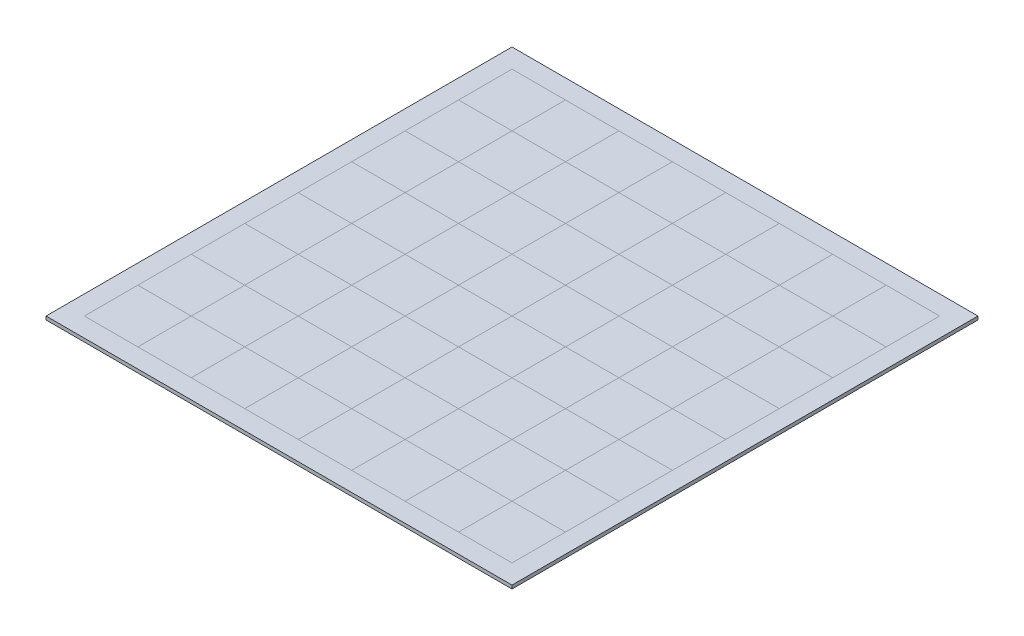
from build123d import *

# Parameters (mm, degrees)
SKETCH1_W              = 39
SKETCH1_H              = 39
BOSS_EXTRUDE1_DEPTH    = 2.5
BOSS_EXTRUDE1_2_DEPTH  = 2.5
BOSS_EXTRUDE1_3_DEPTH  = 2.5
BOSS_EXTRUDE1_4_DEPTH  = 2.5
BOSS_EXTRUDE1_5_DEPTH  = 2.5
BOSS_EXTRUDE1_6_DEPTH  = 2.5
BOSS_EXTRUDE1_7_DEPTH  = 2.5
BOSS_EXTRUDE1_8_DEPTH  = 2.5
BOSS_EXTRUDE1_9_DEPTH  = 2.5
BOSS_EXTRUDE1_10_DEPTH = 2.5
BOSS_EXTRUDE1_11_DEPTH = 2.5
BOSS_EXTRUDE1_12_DEPTH = 2.5
BOSS_EXTRUDE1_13_DEPTH = 2.5
BOSS_EXTRUDE1_14_DEPTH = 2.5
BOSS_EXTRUDE1_15_DEPTH = 2.5
BOSS_EXTRUDE1_16_DEPTH = 2.5
BOSS_EXTRUDE1_17_DEPTH = 2.5
BOSS_EXTRUDE1_18_DEPTH = 2.5
BOSS_EXTRUDE1_19_DEPTH = 2.5
BOSS_EXTRUDE1_20_DEPTH = 2.5
BOSS_EXTRUDE1_21_DEPTH = 2.5
BOSS_EXTRUDE1_22_DEPTH = 2.5
BOSS_EXTRUDE1_23_DEPTH = 2.5
BOSS_EXTRUDE1_24_DEPTH = 2.5
BOSS_EXTRUDE1_25_DEPTH = 2.5
BOSS_EXTRUDE1_26_DEPTH = 2.5
BOSS_EXTRUDE1_27_DEPTH = 2.5
BOSS_EXTRUDE1_28_DEPTH = 2.5
BOSS_EXTRUDE1_29_DEPTH = 2.5
BOSS_EXTRUDE1_30_DEPTH = 2.5
BOSS_EXTRUDE1_31_DEPTH = 2.5
BOSS_EXTRUDE1_32_DEPTH = 2.5
SKETCH4_W              = 39
SKETCH4_H              = 39
BOSS_EXTRUDE2_DEPTH    = 2.5
BOSS_EXTRUDE2_2_DEPTH  = 2.5
BOSS_EXTRUDE2_3_DEPTH  = 2.5
BOSS_EXTRUDE2_4_DEPTH  = 2.5
BOSS_EXTRUDE2_5_DEPTH  = 2.5
BOSS_EXTRUDE2_6_DEPTH  = 2.5
BOSS_EXTRUDE2_7_DEPTH  = 2.5
BOSS_EXTRUDE2_8_DEPTH  = 2.5
BOSS_EXTRUDE2_9_DEPTH  = 2.5
BOSS_EXTRUDE2_10_DEPTH = 2.5
BOSS_EXTRUDE2_11_DEPTH = 2.5
BOSS_EXTRUDE2_12_DEPTH = 2.5
BOSS_EXTRUDE2_13_DEPTH = 2.5
BOSS_EXTRUDE2_14_DEPTH = 2.5
BOSS_EXTRUDE2_15_DEPTH = 2.5
BOSS_EXTRUDE2_16_DEPTH = 2.5
BOSS_EXTRUDE2_17_DEPTH = 2.5
BOSS_EXTRUDE2_18_DEPTH = 2.5
BOSS_EXTRUDE2_19_DEPTH = 2.5
BOSS_EXTRUDE2_20_DEPTH = 2.5
BOSS_EXTRUDE2_21_DEPTH = 2.5
BOSS_EXTRUDE2_22_DEPTH = 2.5
BOSS_EXTRUDE2_23_DEPTH = 2.5
BOSS_EXTRUDE2_24_DEPTH = 2.5
BOSS_EXTRUDE2_25_DEPTH = 2.5
BOSS_EXTRUDE2_26_DEPTH = 2.5
BOSS_EXTRUDE2_27_DEPTH = 2.5
BOSS_EXTRUDE2_28_DEPTH = 2.5
BOSS_EXTRUDE2_29_DEPTH = 2.5
BOSS_EXTRUDE2_30_DEPTH = 2.5
BOSS_EXTRUDE2_31_DEPTH = 2.5
BOSS_EXTRUDE2_32_DEPTH = 2.5
SKETCH5_W              = 340
SKETCH5_H              = 340
SKETCH5_W_2            = 312
SKETCH5_H_2            = 312
BOSS_EXTRUDE3_DEPTH    = 2.5


with BuildPart() as part:
    # Sketch1 → Boss-Extrude1 (new body)
    with BuildSketch(Plane(origin=(0, 0, 0), x_dir=(1, 0, 0), z_dir=(0, 1, 0))):
        Rectangle(SKETCH1_W, SKETCH1_H)
    extrude(amount=BOSS_EXTRUDE1_DEPTH)


with BuildPart() as body_2:
    # Sketch1 → Boss-Extrude1 2 (new body)
    with BuildSketch(Plane(origin=(0, 0, 0), x_dir=(1, 0, 0), z_dir=(0, 1, 0))):
        with Locations((39, 39)):
            Rectangle(SKETCH1_W, SKETCH1_H)
    extrude(amount=BOSS_EXTRUDE1_2_DEPTH)


with BuildPart() as body_3:
    # Sketch1 → Boss-Extrude1 3 (new body)
    with BuildSketch(Plane(origin=(0, 0, 0), x_dir=(1, 0, 0), z_dir=(0, 1, 0))):
        with Locations((78, 0)):
            Rectangle(SKETCH1_W, SKETCH1_H)
    extrude(amount=BOSS_EXTRUDE1_3_DEPTH)


with BuildPart() as body_4:
    # Sketch1 → Boss-Extrude1 4 (new body)
    with BuildSketch(Plane(origin=(0, 0, 0), x_dir=(1, 0, 0), z_dir=(0, 1, 0))):
        with Locations((0, 78)):
            Rectangle(SKETCH1_W, SKETCH1_H)
    extrude(amount=BOSS_EXTRUDE1_4_DEPTH)


with BuildPart() as body_5:
    # Sketch1 → Boss-Extrude1 5 (new body)
    with BuildSketch(Plane(origin=(0, 0, 0), x_dir=(1, 0, 0), z_dir=(0, 1, 0))):
        with Locations((78, 78)):
            Rectangle(SKETCH1_W, SKETCH1_H)
    extrude(amount=BOSS_EXTRUDE1_5_DEPTH)


with BuildPart() as body_6:
    # Sketch1 → Boss-Extrude1 6 (new body)
    with BuildSketch(Plane(origin=(0, 0, 0), x_dir=(1, 0, 0), z_dir=(0, 1, 0))):
        with Locations((39, 117)):
            Rectangle(SKETCH1_W, SKETCH1_H)
    extrude(amount=BOSS_EXTRUDE1_6_DEPTH)


with BuildPart() as body_7:
    # Sketch1 → Boss-Extrude1 7 (new body)
    with BuildSketch(Plane(origin=(0, 0, 0), x_dir=(1, 0, 0), z_dir=(0, 1, 0))):
        with Locations((0, 156)):
            Rectangle(SKETCH1_W, SKETCH1_H)
    extrude(amount=BOSS_EXTRUDE1_7_DEPTH)


with BuildPart() as body_8:
    # Sketch1 → Boss-Extrude1 8 (new body)
    with BuildSketch(Plane(origin=(0, 0, 0), x_dir=(1, 0, 0), z_dir=(0, 1, 0))):
        with Locations((39, 195)):
            Rectangle(SKETCH1_W, SKETCH1_H)
    extrude(amount=BOSS_EXTRUDE1_8_DEPTH)


with BuildPart() as body_9:
    # Sketch1 → Boss-Extrude1 9 (new body)
    with BuildSketch(Plane(origin=(0, 0, 0), x_dir=(1, 0, 0), z_dir=(0, 1, 0))):
        with Locations((0, 234)):
            Rectangle(SKETCH1_W, SKETCH1_H)
    extrude(amount=BOSS_EXTRUDE1_9_DEPTH)


with BuildPart() as body_10:
    # Sketch1 → Boss-Extrude1 10 (new body)
    with BuildSketch(Plane(origin=(0, 0, 0), x_dir=(1, 0, 0), z_dir=(0, 1, 0))):
        with Locations((39, 273)):
            Rectangle(SKETCH1_W, SKETCH1_H)
    extrude(amount=BOSS_EXTRUDE1_10_DEPTH)


with BuildPart() as body_11:
    # Sketch1 → Boss-Extrude1 11 (new body)
    with BuildSketch(Plane(origin=(0, 0, 0), x_dir=(1, 0, 0), z_dir=(0, 1, 0))):
        with Locations((78, 234)):
            Rectangle(SKETCH1_W, SKETCH1_H)
    extrude(amount=BOSS_EXTRUDE1_11_DEPTH)


with BuildPart() as body_12:
    # Sketch1 → Boss-Extrude1 12 (new body)
    with BuildSketch(Plane(origin=(0, 0, 0), x_dir=(1, 0, 0), z_dir=(0, 1, 0))):
        with Locations((117, 273)):
            Rectangle(SKETCH1_W, SKETCH1_H)
    extrude(amount=BOSS_EXTRUDE1_12_DEPTH)


with BuildPart() as body_13:
    # Sketch1 → Boss-Extrude1 13 (new body)
    with BuildSketch(Plane(origin=(0, 0, 0), x_dir=(1, 0, 0), z_dir=(0, 1, 0))):
        with Locations((117, 195)):
            Rectangle(SKETCH1_W, SKETCH1_H)
    extrude(amount=BOSS_EXTRUDE1_13_DEPTH)


with BuildPart() as body_14:
    # Sketch1 → Boss-Extrude1 14 (new body)
    with BuildSketch(Plane(origin=(0, 0, 0), x_dir=(1, 0, 0), z_dir=(0, 1, 0))):
        with Locations((156, 234)):
            Rectangle(SKETCH1_W, SKETCH1_H)
    extrude(amount=BOSS_EXTRUDE1_14_DEPTH)


with BuildPart() as body_15:
    # Sketch1 → Boss-Extrude1 15 (new body)
    with BuildSketch(Plane(origin=(0, 0, 0), x_dir=(1, 0, 0), z_dir=(0, 1, 0))):
        with Locations((195, 273)):
            Rectangle(SKETCH1_W, SKETCH1_H)
    extrude(amount=BOSS_EXTRUDE1_15_DEPTH)


with BuildPart() as body_16:
    # Sketch1 → Boss-Extrude1 16 (new body)
    with BuildSketch(Plane(origin=(0, 0, 0), x_dir=(1, 0, 0), z_dir=(0, 1, 0))):
        with Locations((195, 195)):
            Rectangle(SKETCH1_W, SKETCH1_H)
    extrude(amount=BOSS_EXTRUDE1_16_DEPTH)


with BuildPart() as body_17:
    # Sketch1 → Boss-Extrude1 17 (new body)
    with BuildSketch(Plane(origin=(0, 0, 0), x_dir=(1, 0, 0), z_dir=(0, 1, 0))):
        with Locations((234, 234)):
            Rectangle(SKETCH1_W, SKETCH1_H)
    extrude(amount=BOSS_EXTRUDE1_17_DEPTH)


with BuildPart() as body_18:
    # Sketch1 → Boss-Extrude1 18 (new body)
    with BuildSketch(Plane(origin=(0, 0, 0), x_dir=(1, 0, 0), z_dir=(0, 1, 0))):
        with Locations((273, 273)):
            Rectangle(SKETCH1_W, SKETCH1_H)
    extrude(amount=BOSS_EXTRUDE1_18_DEPTH)


with BuildPart() as body_19:
    # Sketch1 → Boss-Extrude1 19 (new body)
    with BuildSketch(Plane(origin=(0, 0, 0), x_dir=(1, 0, 0), z_dir=(0, 1, 0))):
        with Locations((273, 195)):
            Rectangle(SKETCH1_W, SKETCH1_H)
    extrude(amount=BOSS_EXTRUDE1_19_DEPTH)


with BuildPart() as body_20:
    # Sketch1 → Boss-Extrude1 20 (new body)
    with BuildSketch(Plane(origin=(0, 0, 0), x_dir=(1, 0, 0), z_dir=(0, 1, 0))):
        with Locations((234, 156)):
            Rectangle(SKETCH1_W, SKETCH1_H)
    extrude(amount=BOSS_EXTRUDE1_20_DEPTH)


with BuildPart() as body_21:
    # Sketch1 → Boss-Extrude1 21 (new body)
    with BuildSketch(Plane(origin=(0, 0, 0), x_dir=(1, 0, 0), z_dir=(0, 1, 0))):
        with Locations((195, 117)):
            Rectangle(SKETCH1_W, SKETCH1_H)
    extrude(amount=BOSS_EXTRUDE1_21_DEPTH)


with BuildPart() as body_22:
    # Sketch1 → Boss-Extrude1 22 (new body)
    with BuildSketch(Plane(origin=(0, 0, 0), x_dir=(1, 0, 0), z_dir=(0, 1, 0))):
        with Locations((156, 156)):
            Rectangle(SKETCH1_W, SKETCH1_H)
    extrude(amount=BOSS_EXTRUDE1_22_DEPTH)


with BuildPart() as body_23:
    # Sketch1 → Boss-Extrude1 23 (new body)
    with BuildSketch(Plane(origin=(0, 0, 0), x_dir=(1, 0, 0), z_dir=(0, 1, 0))):
        with Locations((78, 156)):
            Rectangle(SKETCH1_W, SKETCH1_H)
    extrude(amount=BOSS_EXTRUDE1_23_DEPTH)


with BuildPart() as body_24:
    # Sketch1 → Boss-Extrude1 24 (new body)
    with BuildSketch(Plane(origin=(0, 0, 0), x_dir=(1, 0, 0), z_dir=(0, 1, 0))):
        with Locations((117, 117)):
            Rectangle(SKETCH1_W, SKETCH1_H)
    extrude(amount=BOSS_EXTRUDE1_24_DEPTH)


with BuildPart() as body_25:
    # Sketch1 → Boss-Extrude1 25 (new body)
    with BuildSketch(Plane(origin=(0, 0, 0), x_dir=(1, 0, 0), z_dir=(0, 1, 0))):
        with Locations((156, 78)):
            Rectangle(SKETCH1_W, SKETCH1_H)
    extrude(amount=BOSS_EXTRUDE1_25_DEPTH)


with BuildPart() as body_26:
    # Sketch1 → Boss-Extrude1 26 (new body)
    with BuildSketch(Plane(origin=(0, 0, 0), x_dir=(1, 0, 0), z_dir=(0, 1, 0))):
        with Locations((195, 39)):
            Rectangle(SKETCH1_W, SKETCH1_H)
    extrude(amount=BOSS_EXTRUDE1_26_DEPTH)


with BuildPart() as body_27:
    # Sketch1 → Boss-Extrude1 27 (new body)
    with BuildSketch(Plane(origin=(0, 0, 0), x_dir=(1, 0, 0), z_dir=(0, 1, 0))):
        with Locations((117, 39)):
            Rectangle(SKETCH1_W, SKETCH1_H)
    extrude(amount=BOSS_EXTRUDE1_27_DEPTH)


with BuildPart() as body_28:
    # Sketch1 → Boss-Extrude1 28 (new body)
    with BuildSketch(Plane(origin=(0, 0, 0), x_dir=(1, 0, 0), z_dir=(0, 1, 0))):
        with Locations((156, 0)):
            Rectangle(SKETCH1_W, SKETCH1_H)
    extrude(amount=BOSS_EXTRUDE1_28_DEPTH)


with BuildPart() as body_29:
    # Sketch1 → Boss-Extrude1 29 (new body)
    with BuildSketch(Plane(origin=(0, 0, 0), x_dir=(1, 0, 0), z_dir=(0, 1, 0))):
        with Locations((234, 0)):
            Rectangle(SKETCH1_W, SKETCH1_H)
    extrude(amount=BOSS_EXTRUDE1_29_DEPTH)


with BuildPart() as body_30:
    # Sketch1 → Boss-Extrude1 30 (new body)
    with BuildSketch(Plane(origin=(0, 0, 0), x_dir=(1, 0, 0), z_dir=(0, 1, 0))):
        with Locations((273, 39)):
            Rectangle(SKETCH1_W, SKETCH1_H)
    extrude(amount=BOSS_EXTRUDE1_30_DEPTH)


with BuildPart() as body_31:
    # Sketch1 → Boss-Extrude1 31 (new body)
    with BuildSketch(Plane(origin=(0, 0, 0), x_dir=(1, 0, 0), z_dir=(0, 1, 0))):
        with Locations((234, 78)):
            Rectangle(SKETCH1_W, SKETCH1_H)
    extrude(amount=BOSS_EXTRUDE1_31_DEPTH)


with BuildPart() as body_32:
    # Sketch1 → Boss-Extrude1 32 (new body)
    with BuildSketch(Plane(origin=(0, 0, 0), x_dir=(1, 0, 0), z_dir=(0, 1, 0))):
        with Locations((273, 117)):
            Rectangle(SKETCH1_W, SKETCH1_H)
    extrude(amount=BOSS_EXTRUDE1_32_DEPTH)


with BuildPart() as body_33:
    # Sketch4 → Boss-Extrude2 (new body)
    with BuildSketch(Plane(origin=(0, 0, 0), x_dir=(1, 0, 0), z_dir=(0, 1, 0))):
        with Locations((0, 273)):
            Rectangle(SKETCH4_W, SKETCH4_H)
    extrude(amount=BOSS_EXTRUDE2_DEPTH)


with BuildPart() as body_34:
    # Sketch4 → Boss-Extrude2 2 (new body)
    with BuildSketch(Plane(origin=(0, 0, 0), x_dir=(1, 0, 0), z_dir=(0, 1, 0))):
        with Locations((39, 234)):
            Rectangle(SKETCH4_W, SKETCH4_H)
    extrude(amount=BOSS_EXTRUDE2_2_DEPTH)


with BuildPart() as body_35:
    # Sketch4 → Boss-Extrude2 3 (new body)
    with BuildSketch(Plane(origin=(0, 0, 0), x_dir=(1, 0, 0), z_dir=(0, 1, 0))):
        with Locations((78, 273)):
            Rectangle(SKETCH4_W, SKETCH4_H)
    extrude(amount=BOSS_EXTRUDE2_3_DEPTH)


with BuildPart() as body_36:
    # Sketch4 → Boss-Extrude2 4 (new body)
    with BuildSketch(Plane(origin=(0, 0, 0), x_dir=(1, 0, 0), z_dir=(0, 1, 0))):
        with Locations((0, 195)):
            Rectangle(SKETCH4_W, SKETCH4_H)
    extrude(amount=BOSS_EXTRUDE2_4_DEPTH)


with BuildPart() as body_37:
    # Sketch4 → Boss-Extrude2 5 (new body)
    with BuildSketch(Plane(origin=(0, 0, 0), x_dir=(1, 0, 0), z_dir=(0, 1, 0))):
        with Locations((78, 195)):
            Rectangle(SKETCH4_W, SKETCH4_H)
    extrude(amount=BOSS_EXTRUDE2_5_DEPTH)


with BuildPart() as body_38:
    # Sketch4 → Boss-Extrude2 6 (new body)
    with BuildSketch(Plane(origin=(0, 0, 0), x_dir=(1, 0, 0), z_dir=(0, 1, 0))):
        with Locations((39, 156)):
            Rectangle(SKETCH4_W, SKETCH4_H)
    extrude(amount=BOSS_EXTRUDE2_6_DEPTH)


with BuildPart() as body_39:
    # Sketch4 → Boss-Extrude2 7 (new body)
    with BuildSketch(Plane(origin=(0, 0, 0), x_dir=(1, 0, 0), z_dir=(0, 1, 0))):
        with Locations((0, 117)):
            Rectangle(SKETCH4_W, SKETCH4_H)
    extrude(amount=BOSS_EXTRUDE2_7_DEPTH)


with BuildPart() as body_40:
    # Sketch4 → Boss-Extrude2 8 (new body)
    with BuildSketch(Plane(origin=(0, 0, 0), x_dir=(1, 0, 0), z_dir=(0, 1, 0))):
        with Locations((78, 117)):
            Rectangle(SKETCH4_W, SKETCH4_H)
    extrude(amount=BOSS_EXTRUDE2_8_DEPTH)


with BuildPart() as body_41:
    # Sketch4 → Boss-Extrude2 9 (new body)
    with BuildSketch(Plane(origin=(0, 0, 0), x_dir=(1, 0, 0), z_dir=(0, 1, 0))):
        with Locations((39, 78)):
            Rectangle(SKETCH4_W, SKETCH4_H)
    extrude(amount=BOSS_EXTRUDE2_9_DEPTH)


with BuildPart() as body_42:
    # Sketch4 → Boss-Extrude2 10 (new body)
    with BuildSketch(Plane(origin=(0, 0, 0), x_dir=(1, 0, 0), z_dir=(0, 1, 0))):
        with Locations((0, 39)):
            Rectangle(SKETCH4_W, SKETCH4_H)
    extrude(amount=BOSS_EXTRUDE2_10_DEPTH)


with BuildPart() as body_43:
    # Sketch4 → Boss-Extrude2 11 (new body)
    with BuildSketch(Plane(origin=(0, 0, 0), x_dir=(1, 0, 0), z_dir=(0, 1, 0))):
        with Locations((39, 0)):
            Rectangle(SKETCH4_W, SKETCH4_H)
    extrude(amount=BOSS_EXTRUDE2_11_DEPTH)


with BuildPart() as body_44:
    # Sketch4 → Boss-Extrude2 12 (new body)
    with BuildSketch(Plane(origin=(0, 0, 0), x_dir=(1, 0, 0), z_dir=(0, 1, 0))):
        with Locations((78, 39)):
            Rectangle(SKETCH4_W, SKETCH4_H)
    extrude(amount=BOSS_EXTRUDE2_12_DEPTH)


with BuildPart() as body_45:
    # Sketch4 → Boss-Extrude2 13 (new body)
    with BuildSketch(Plane(origin=(0, 0, 0), x_dir=(1, 0, 0), z_dir=(0, 1, 0))):
        with Locations((117, 0)):
            Rectangle(SKETCH4_W, SKETCH4_H)
    extrude(amount=BOSS_EXTRUDE2_13_DEPTH)


with BuildPart() as body_46:
    # Sketch4 → Boss-Extrude2 14 (new body)
    with BuildSketch(Plane(origin=(0, 0, 0), x_dir=(1, 0, 0), z_dir=(0, 1, 0))):
        with Locations((117, 78)):
            Rectangle(SKETCH4_W, SKETCH4_H)
    extrude(amount=BOSS_EXTRUDE2_14_DEPTH)


with BuildPart() as body_47:
    # Sketch4 → Boss-Extrude2 15 (new body)
    with BuildSketch(Plane(origin=(0, 0, 0), x_dir=(1, 0, 0), z_dir=(0, 1, 0))):
        with Locations((117, 156)):
            Rectangle(SKETCH4_W, SKETCH4_H)
    extrude(amount=BOSS_EXTRUDE2_15_DEPTH)


with BuildPart() as body_48:
    # Sketch4 → Boss-Extrude2 16 (new body)
    with BuildSketch(Plane(origin=(0, 0, 0), x_dir=(1, 0, 0), z_dir=(0, 1, 0))):
        with Locations((117, 234)):
            Rectangle(SKETCH4_W, SKETCH4_H)
    extrude(amount=BOSS_EXTRUDE2_16_DEPTH)


with BuildPart() as body_49:
    # Sketch4 → Boss-Extrude2 17 (new body)
    with BuildSketch(Plane(origin=(0, 0, 0), x_dir=(1, 0, 0), z_dir=(0, 1, 0))):
        with Locations((156, 273)):
            Rectangle(SKETCH4_W, SKETCH4_H)
    extrude(amount=BOSS_EXTRUDE2_17_DEPTH)


with BuildPart() as body_50:
    # Sketch4 → Boss-Extrude2 18 (new body)
    with BuildSketch(Plane(origin=(0, 0, 0), x_dir=(1, 0, 0), z_dir=(0, 1, 0))):
        with Locations((195, 234)):
            Rectangle(SKETCH4_W, SKETCH4_H)
    extrude(amount=BOSS_EXTRUDE2_18_DEPTH)


with BuildPart() as body_51:
    # Sketch4 → Boss-Extrude2 19 (new body)
    with BuildSketch(Plane(origin=(0, 0, 0), x_dir=(1, 0, 0), z_dir=(0, 1, 0))):
        with Locations((156, 195)):
            Rectangle(SKETCH4_W, SKETCH4_H)
    extrude(amount=BOSS_EXTRUDE2_19_DEPTH)


with BuildPart() as body_52:
    # Sketch4 → Boss-Extrude2 20 (new body)
    with BuildSketch(Plane(origin=(0, 0, 0), x_dir=(1, 0, 0), z_dir=(0, 1, 0))):
        with Locations((156, 117)):
            Rectangle(SKETCH4_W, SKETCH4_H)
    extrude(amount=BOSS_EXTRUDE2_20_DEPTH)


with BuildPart() as body_53:
    # Sketch4 → Boss-Extrude2 21 (new body)
    with BuildSketch(Plane(origin=(0, 0, 0), x_dir=(1, 0, 0), z_dir=(0, 1, 0))):
        with Locations((195, 156)):
            Rectangle(SKETCH4_W, SKETCH4_H)
    extrude(amount=BOSS_EXTRUDE2_21_DEPTH)


with BuildPart() as body_54:
    # Sketch4 → Boss-Extrude2 22 (new body)
    with BuildSketch(Plane(origin=(0, 0, 0), x_dir=(1, 0, 0), z_dir=(0, 1, 0))):
        with Locations((234, 195)):
            Rectangle(SKETCH4_W, SKETCH4_H)
    extrude(amount=BOSS_EXTRUDE2_22_DEPTH)


with BuildPart() as body_55:
    # Sketch4 → Boss-Extrude2 23 (new body)
    with BuildSketch(Plane(origin=(0, 0, 0), x_dir=(1, 0, 0), z_dir=(0, 1, 0))):
        with Locations((273, 234)):
            Rectangle(SKETCH4_W, SKETCH4_H)
    extrude(amount=BOSS_EXTRUDE2_23_DEPTH)


with BuildPart() as body_56:
    # Sketch4 → Boss-Extrude2 24 (new body)
    with BuildSketch(Plane(origin=(0, 0, 0), x_dir=(1, 0, 0), z_dir=(0, 1, 0))):
        with Locations((234, 273)):
            Rectangle(SKETCH4_W, SKETCH4_H)
    extrude(amount=BOSS_EXTRUDE2_24_DEPTH)


with BuildPart() as body_57:
    # Sketch4 → Boss-Extrude2 25 (new body)
    with BuildSketch(Plane(origin=(0, 0, 0), x_dir=(1, 0, 0), z_dir=(0, 1, 0))):
        with Locations((273, 156)):
            Rectangle(SKETCH4_W, SKETCH4_H)
    extrude(amount=BOSS_EXTRUDE2_25_DEPTH)


with BuildPart() as body_58:
    # Sketch4 → Boss-Extrude2 26 (new body)
    with BuildSketch(Plane(origin=(0, 0, 0), x_dir=(1, 0, 0), z_dir=(0, 1, 0))):
        with Locations((234, 117)):
            Rectangle(SKETCH4_W, SKETCH4_H)
    extrude(amount=BOSS_EXTRUDE2_26_DEPTH)


with BuildPart() as body_59:
    # Sketch4 → Boss-Extrude2 27 (new body)
    with BuildSketch(Plane(origin=(0, 0, 0), x_dir=(1, 0, 0), z_dir=(0, 1, 0))):
        with Locations((195, 78)):
            Rectangle(SKETCH4_W, SKETCH4_H)
    extrude(amount=BOSS_EXTRUDE2_27_DEPTH)


with BuildPart() as body_60:
    # Sketch4 → Boss-Extrude2 28 (new body)
    with BuildSketch(Plane(origin=(0, 0, 0), x_dir=(1, 0, 0), z_dir=(0, 1, 0))):
        with Locations((273, 78)):
            Rectangle(SKETCH4_W, SKETCH4_H)
    extrude(amount=BOSS_EXTRUDE2_28_DEPTH)


with BuildPart() as body_61:
    # Sketch4 → Boss-Extrude2 29 (new body)
    with BuildSketch(Plane(origin=(0, 0, 0), x_dir=(1, 0, 0), z_dir=(0, 1, 0))):
        with Locations((234, 39)):
            Rectangle(SKETCH4_W, SKETCH4_H)
    extrude(amount=BOSS_EXTRUDE2_29_DEPTH)


with BuildPart() as body_62:
    # Sketch4 → Boss-Extrude2 30 (new body)
    with BuildSketch(Plane(origin=(0, 0, 0), x_dir=(1, 0, 0), z_dir=(0, 1, 0))):
        with Locations((156, 39)):
            Rectangle(SKETCH4_W, SKETCH4_H)
    extrude(amount=BOSS_EXTRUDE2_30_DEPTH)


with BuildPart() as body_63:
    # Sketch4 → Boss-Extrude2 31 (new body)
    with BuildSketch(Plane(origin=(0, 0, 0), x_dir=(1, 0, 0), z_dir=(0, 1, 0))):
        with Locations((195, 0)):
            Rectangle(SKETCH4_W, SKETCH4_H)
    extrude(amount=BOSS_EXTRUDE2_31_DEPTH)


with BuildPart() as body_64:
    # Sketch4 → Boss-Extrude2 32 (new body)
    with BuildSketch(Plane(origin=(0, 0, 0), x_dir=(1, 0, 0), z_dir=(0, 1, 0))):
        with Locations((273, 0)):
            Rectangle(SKETCH4_W, SKETCH4_H)
    extrude(amount=BOSS_EXTRUDE2_32_DEPTH)


with BuildPart() as body_65:
    # Sketch5 → Boss-Extrude3 (new body)
    with BuildSketch(Plane(origin=(0, 0, 0), x_dir=(1, 0, 0), z_dir=(0, 1, 0))):
        with Locations((136.5, 136.5)):
            Rectangle(SKETCH5_W, SKETCH5_H)
        with Locations((136.5, 136.5)):
            Rectangle(SKETCH5_W_2, SKETCH5_H_2, mode=Mode.SUBTRACT)
    extrude(amount=BOSS_EXTRUDE3_DEPTH)


solid = Compound([part.part, body_2.part, body_3.part, body_4.part, body_5.part, body_6.part, body_7.part, body_8.part, body_9.part, body_10.part, body_11.part, body_12.part, body_13.part, body_14.part, body_15.part, body_16.part, body_17.part, body_18.part, body_19.part, body_20.part, body_21.part, body_22.part, body_23.part, body_24.part, body_25.part, body_26.part, body_27.part, body_28.part, body_29.part, body_30.part, body_31.part, body_32.part, body_33.part, body_34.part, body_35.part, body_36.part, body_37.part, body_38.part, body_39.part, body_40.part, body_41.part, body_42.part, body_43.part, body_44.part, body_45.part, body_46.part, body_47.part, body_48.part, body_49.part, body_50.part, body_51.part, body_52.part, body_53.part, body_54.part, body_55.part, body_56.part, body_57.part, body_58.part, body_59.part, body_60.part, body_61.part, body_62.part, body_63.part, body_64.part, body_65.part])
